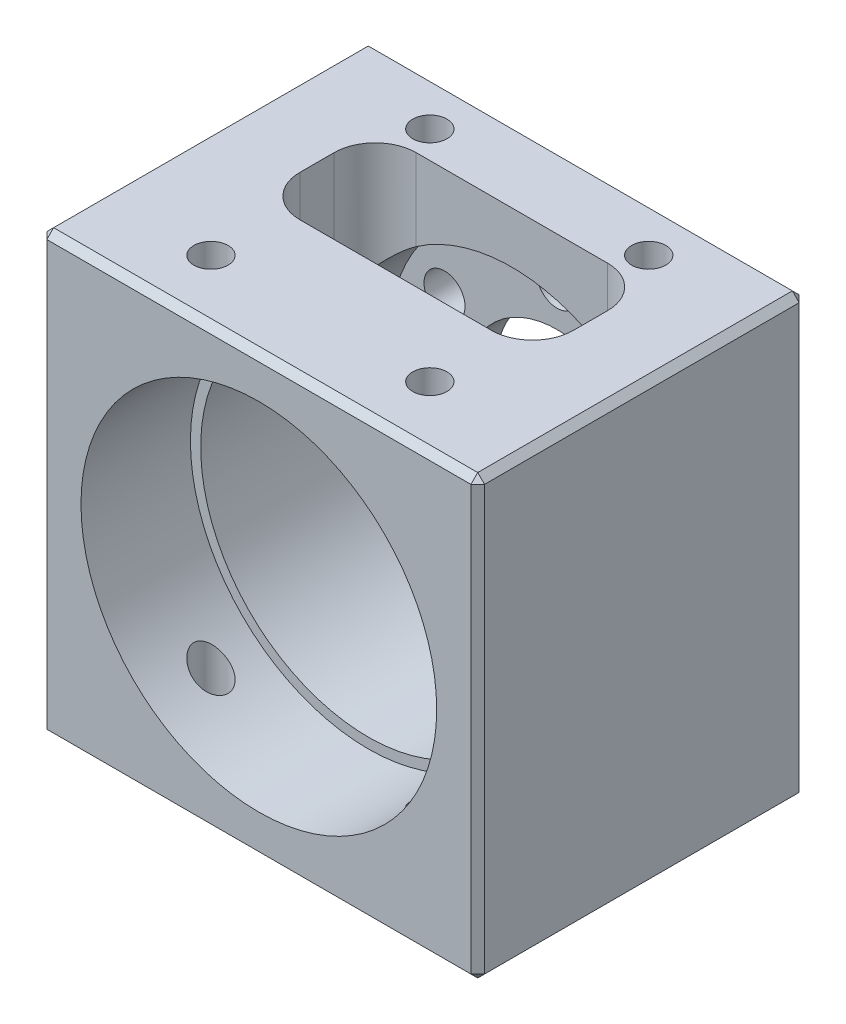
from build123d import *

# Parameters (mm, degrees)
SKETCH_1_R               = 16
SKETCH_1_R_2             = 6.65
EXTRUDE_1_DEPTH          = 24
SKETCH_3_R               = 1.5
CUT_EXTRUDE_2_DEPTH      = 33.984845005
PATTERN_CIRCULAR_1_COUNT = 6
EXTRUDE_START            = -24
EXTRUDE_2_DEPTH          = 24
SKETCH_7_R               = 13
CUT_EXTRUDE_3_DEPTH      = 21.8
EXTRUDE_START_2          = 13.8
SKETCH_15_R              = 13
SKETCH_15_R_2            = 12.25
EXTRUDE_4_DEPTH          = 13.8
SKETCH_11_W              = 20
SKETCH_11_H              = 8.5
CUT_EXTRUDE_4_DEPTH      = 10
FILLET_1_R               = 3
SKETCH_12_R              = 1
CUT_EXTRUDE_5_DEPTH      = 44.081318457
HOLE_WIZARD_M3_1_D       = 2.5
CHAMFER_1_SIZE           = 0.5


with BuildPart() as part:
    # 草图1 → 凸台-拉伸1 (new body)
    with BuildSketch(Plane.XY):
        Circle(SKETCH_1_R)
        Circle(SKETCH_1_R_2, mode=Mode.SUBTRACT)
    extrude(amount=EXTRUDE_1_DEPTH)

    # 草图3 → 切除-拉伸2 (cut, through all)
    with BuildSketch(Plane(origin=(0, 0, 0), x_dir=(-1, 0, 0), z_dir=(0, 0, -1))):
        with Locations((0, 9.5)):
            Circle(SKETCH_3_R)
    cut_extrude_2 = extrude(amount=-CUT_EXTRUDE_2_DEPTH, mode=Mode.SUBTRACT)

    # 阵列(圆周)1: 切除-拉伸2 ×6 about axis
    pattern_circular_1_axis = Axis((0, 0, 0), (0, 0, 1))
    for i in range(1, PATTERN_CIRCULAR_1_COUNT):
        add(cut_extrude_2.rotate(pattern_circular_1_axis, i * 360 / PATTERN_CIRCULAR_1_COUNT), mode=Mode.SUBTRACT)

    # 草图4 → 凸台-拉伸2 (add)
    with BuildSketch(Plane.XY.offset(24).offset(EXTRUDE_START)):
        with BuildLine():
            ThreePointArc((16, 0), (11.313708518, -11.31370848), (5.5e-08, -16))
            Line((5.5e-08, -16), (16, -16))
            Line((16, -16), (16, 0))
        make_face()
        with BuildLine():
            ThreePointArc((5.5e-08, -16), (-11.31370848, -11.313708518), (-16, 0))
            Line((-16, 0), (-16, -16))
            Line((-16, -16), (5.5e-08, -16))
        make_face()
        with BuildLine():
            Line((-16, 16), (-16, 0))
            ThreePointArc((-16, 0), (-11.313708518, 11.31370848), (-5.5e-08, 16))
            Line((-5.5e-08, 16), (-16, 16))
        make_face()
        with BuildLine():
            Line((16, 16), (-5.5e-08, 16))
            ThreePointArc((-5.5e-08, 16), (11.31370848, 11.313708518), (16, 0))
            Line((16, 0), (16, 16))
        make_face()
    extrude(amount=EXTRUDE_2_DEPTH)

    # 草图7 → 切除-拉伸3 (cut)
    with BuildSketch(Plane.XY.offset(24)):
        Circle(SKETCH_7_R)
    extrude(amount=-CUT_EXTRUDE_3_DEPTH, mode=Mode.SUBTRACT)

    # 草图15 → 凸台-拉伸4 (add)
    with BuildSketch(Plane.XY.offset(2.2).offset(EXTRUDE_START_2)):
        Circle(SKETCH_15_R)
        Circle(SKETCH_15_R_2, mode=Mode.SUBTRACT)
    extrude(amount=-EXTRUDE_4_DEPTH)

    # 草图11 → 切除-拉伸4 (cut)
    with BuildSketch(Plane(origin=(0, 16, 0), x_dir=(1, 0, 0), z_dir=(0, 1, 0))):
        with Locations((0, -9.75)):
            Rectangle(SKETCH_11_W, SKETCH_11_H)
    extrude(amount=-CUT_EXTRUDE_4_DEPTH, mode=Mode.SUBTRACT)

    # 圆角1
    fillet_1_edges = [part.edges().sort_by_distance(p)[0] for p in [
        (10, 11.537742925, 5.5),
        (10, 11.537742925, 14),
        (-10, 11.537742925, 14),
        (-10, 11.537742925, 5.5),
    ]]
    fillet(fillet_1_edges, radius=FILLET_1_R)

    # 草图12 → 切除-拉伸5 (cut, through all)
    with BuildSketch(Plane(origin=(0, 16, 0), x_dir=(1, 0, 0), z_dir=(0, 1, 0))):
        with Locations(Location((8, -3.5, 0), (0, 0, 180))):
            Circle(SKETCH_12_R)
        with Locations(Location((8, -19.5, 0), (0, 0, 180))):
            Circle(SKETCH_12_R)
        with Locations(Location((-8, -3.5, 0), (0, 0, 180))):
            Circle(SKETCH_12_R)
        with Locations(Location((-8, -19.5, 0), (0, 0, 180))):
            Circle(SKETCH_12_R)
    extrude(amount=-CUT_EXTRUDE_5_DEPTH, mode=Mode.SUBTRACT)

    # M3 螺纹孔1 (through all)
    with Locations(Plane(origin=(0, 16, 0), x_dir=(1, 0, 0), z_dir=(0, 1, 0))):
        with Locations((8, -3.5), (-8, -3.5), (-8, -19.5), (8, -19.5)):
            Hole(HOLE_WIZARD_M3_1_D / 2)

    # 倒角1
    chamfer_1_edges = [part.edges().sort_by_distance(p)[0] for p in [
        (0, -16, 24),
        (16, -16, 12),
        (16, 0, 0),
        (16, 0, 24),
        (0, -16, 0),
        (-16, -16, 12),
        (-16, 0, 24),
        (-16, 0, 0),
        (0, 16, 0),
        (-16, 16, 12),
        (0, 16, 24),
        (16, 16, 12),
    ]]
    chamfer(chamfer_1_edges, length=CHAMFER_1_SIZE)


solid = part.part
